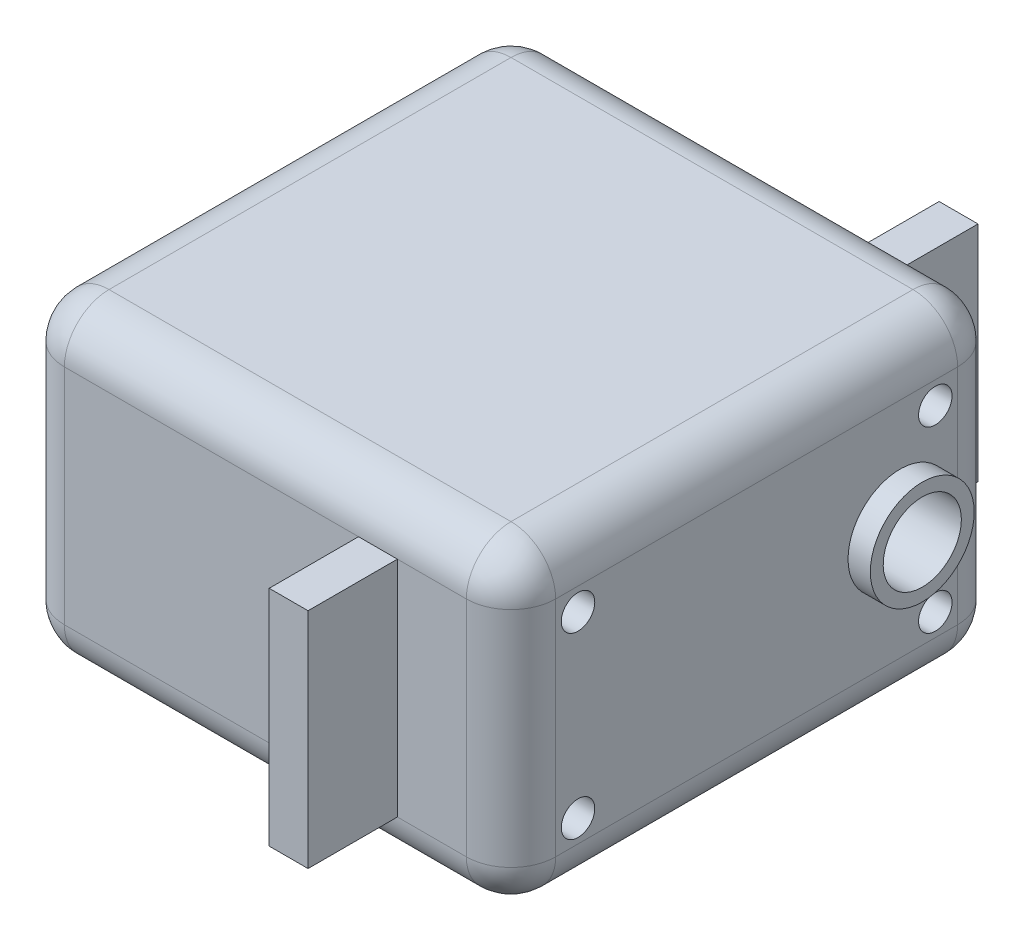
from build123d import *

# Parameters (mm, degrees)
SKETCH1_W                = 22
SKETCH1_H                = 14
BOSS_EXTRUDE1_DEPTH      = 11
FILLET1_R                = 2
SKETCH4_R                = 0.75
CUT_EXTRUDE1_DEPTH       = 28
SKETCH5_R                = 2.324910534
SKETCH5_R_2              = 1.75
BOSS_EXTRUDE2_DEPTH      = 1
CUT_EXTRUDE2_START       = -10
SKETCH5_2_R              = 1.75
CUT_EXTRUDE2_DEPTH       = 10
BOSS_EXTRUDE3_DEPTH      = 4
BOSS_EXTRUDE3_DEPTH_BACK = 26
SKETCH6_W                = 1.741069399
SKETCH6_H                = 10


with BuildPart() as part:
    # Sketch1 → Boss-Extrude1 (new, symmetric)
    with BuildSketch(Plane.XY):
        Rectangle(SKETCH1_W, SKETCH1_H)
    extrude(amount=BOSS_EXTRUDE1_DEPTH, both=True)

    # Fillet1
    fillet1_edges = [part.edges().sort_by_distance(p)[0] for p in [
        (-11, 0, 11),
        (0, -7, 11),
        (11, 0, 11),
        (0, -7, -11),
        (-11, 0, -11),
        (0, 7, -11),
        (11, 0, -11),
        (0, 7, 11),
        (11, -7, 0),
        (-11, -7, 0),
        (-11, 7, 0),
        (11, 7, 0),
    ]]
    fillet(fillet1_edges, radius=FILLET1_R)

    # Sketch4 → Cut-Extrude1 (cut)
    with BuildSketch(Plane(origin=(11, 0, 0), x_dir=(0, 0, -1), z_dir=(1, 0, 0))):
        with Locations((-8, 4)):
            Circle(SKETCH4_R)
        with Locations((-8, -4)):
            Circle(SKETCH4_R)
        with Locations((8, -4)):
            Circle(SKETCH4_R)
        with Locations((8, 4)):
            Circle(SKETCH4_R)
    extrude(amount=-CUT_EXTRUDE1_DEPTH, mode=Mode.SUBTRACT)

    # Sketch5 → Boss-Extrude2 (add)
    with BuildSketch(Plane(origin=(11, 0, 0), x_dir=(0, 0, -1), z_dir=(1, 0, 0))):
        with Locations(Location((6.416436668, 0, 0), (0, 0, 180))):
            Circle(SKETCH5_R)
        with Locations((6.416436668, 0)):
            Circle(SKETCH5_R_2, mode=Mode.SUBTRACT)
    extrude(amount=BOSS_EXTRUDE2_DEPTH)

    # Sketch5<2> → Cut-Extrude2 (cut)
    with BuildSketch(Plane(origin=(11, 0, 0), x_dir=(0, 0, -1), z_dir=(1, 0, 0)).offset(CUT_EXTRUDE2_START)):
        with Locations((6.416436668, 0)):
            Circle(SKETCH5_2_R)
    extrude(amount=CUT_EXTRUDE2_DEPTH, mode=Mode.SUBTRACT)

    # Sketch6 → Boss-Extrude3 (add, two sides: drawn at the far end of the back side and taken through both)
    with BuildSketch(Plane(origin=(0, 0, -11), x_dir=(-1, 0, 0), z_dir=(0, 0, -1)).offset(-BOSS_EXTRUDE3_DEPTH_BACK)):
        with Locations((-5.041276298, 0)):
            Rectangle(SKETCH6_W, SKETCH6_H)
    extrude(amount=BOSS_EXTRUDE3_DEPTH + BOSS_EXTRUDE3_DEPTH_BACK)


solid = part.part
